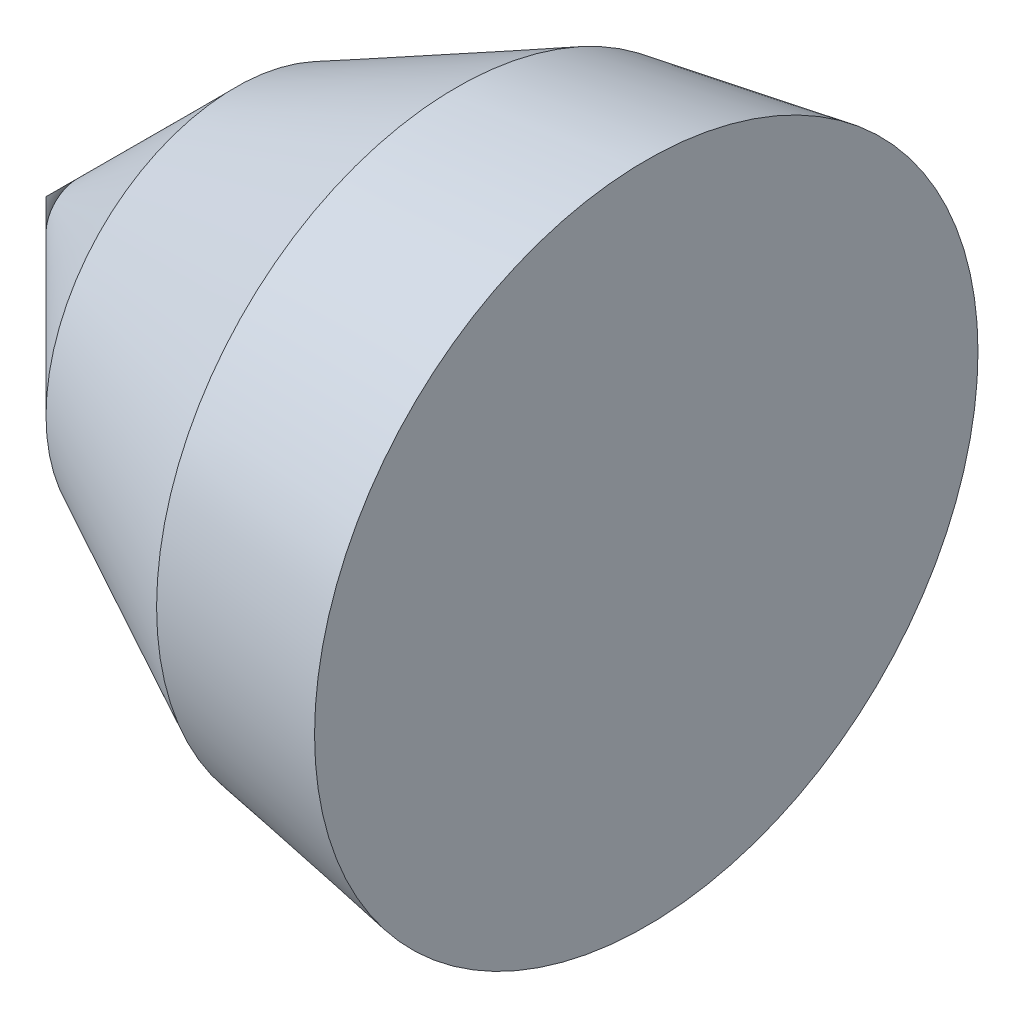
from build123d import *


with BuildPart() as part:
    # Sketch1 → Revolve1 (revolve)
    with BuildSketch(Plane.XY, mode=Mode.PRIVATE) as revolve1_sk:
        Polygon((0, 0), (0, 21), (-12, 19), (-26, 12), (-38, 0), align=None)
    revolve(revolve1_sk.sketch.rotate(Axis((-10, 0, 0), (1, 0, 0)), 90), axis=Axis((-10, 0, 0), (1, 0, 0)))


solid = part.part
